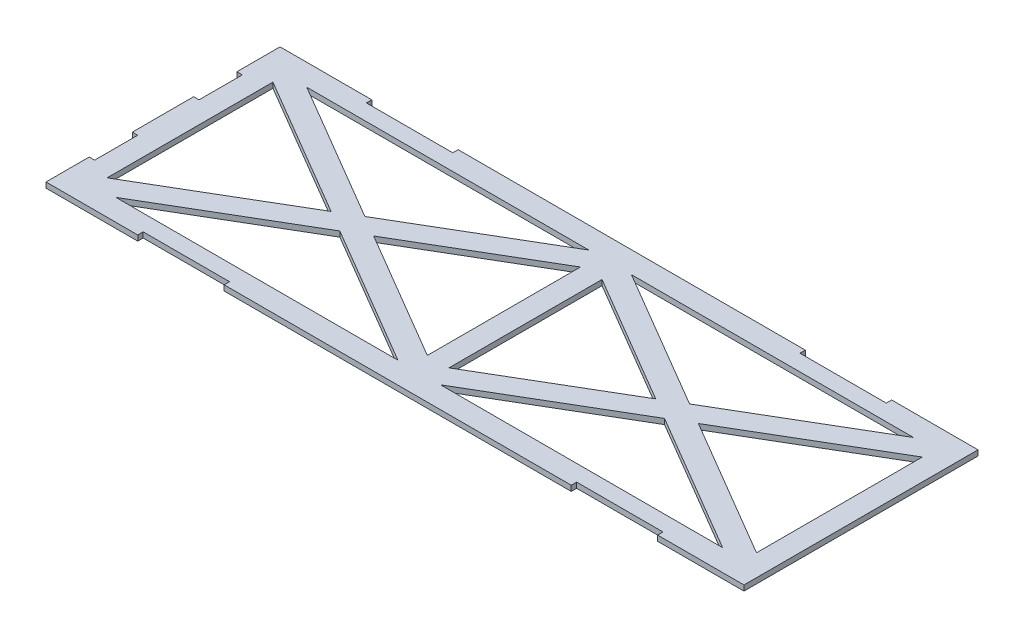
from build123d import *

# Parameters (mm, degrees)
BOSS_EXTRUDE1_DEPTH = 3.175


with BuildPart() as part:
    # Sketch1 → Boss-Extrude1 (new body)
    with BuildSketch(Plane(origin=(0, 0, 0), x_dir=(1, 0, 0), z_dir=(0, 1, 0))):
        Polygon((-203.6953, 68.834), (-152.8953, 68.834), (-152.8953, 65.659), (-102.0953, 65.659), (-102.0953, 68.834), (102.0953, 68.834), (102.0953, 65.659), (152.8953, 65.659), (152.8953, 68.834), (203.6953, 68.834), (203.6953, -68.834), (152.8953, -68.834), (152.8953, -65.659), (102.0953, -65.659), (102.0953, -68.834), (-102.0953, -68.834), (-102.0953, -65.659), (-152.8953, -65.659), (-152.8953, -68.834), (-203.6953, -68.834), (-206.8703, -68.834), (-206.8703, -43.434), (-203.6953, -43.434), (-203.6953, -18.034), (-206.8703, -18.034), (-206.8703, 18.034), (-203.6953, 18.034), (-203.6953, 43.434), (-206.8703, 43.434), (-206.8703, 68.834), align=None)
        Polygon((-178.464331058, 56.134), (-12.530968942, 56.134), (-95.49765, 7.365766703), align=None, mode=Mode.SUBTRACT)
        Polygon((-190.9953, 48.768233297), (-190.9953, -48.768233297), (-108.028618942, 0), align=None, mode=Mode.SUBTRACT)
        Polygon((-178.464331058, -56.134), (-12.530968942, -56.134), (-95.49765, -7.365766703), align=None, mode=Mode.SUBTRACT)
        Polygon((190.9953, 48.768233297), (190.9953, -48.768233297), (108.028618942, 0), align=None, mode=Mode.SUBTRACT)
        Polygon((6.35, 45.035671291), (6.35, -45.035671291), (82.966681058, 0), align=None, mode=Mode.SUBTRACT)
        Polygon((12.530968942, 56.134), (95.49765, 7.365766703), (178.464331058, 56.134), align=None, mode=Mode.SUBTRACT)
        Polygon((-6.35, 45.035671291), (-6.35, -45.035671291), (-82.966681058, 0), align=None, mode=Mode.SUBTRACT)
        Polygon((12.530968942, -56.134), (178.464331058, -56.134), (95.49765, -7.365766703), align=None, mode=Mode.SUBTRACT)
    extrude(amount=BOSS_EXTRUDE1_DEPTH)


solid = part.part
